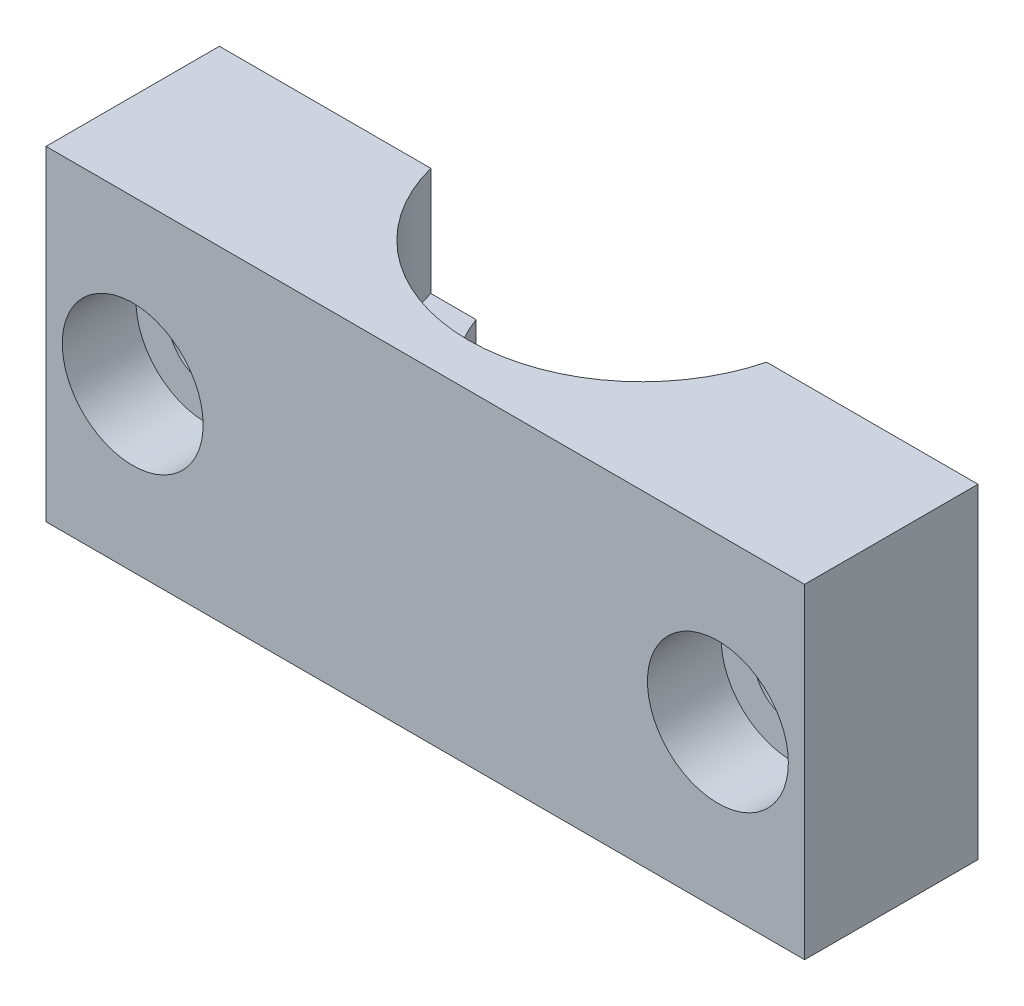
from build123d import *

# Parameters (mm, degrees)
SKETCH1_W                                           = 35
SKETCH1_H                                           = 15
BOSS_EXTRUDE1_DEPTH                                 = 10
CUT_REVOLVE1_ANGLE                                  = 180
SKETCH3_R                                           = 1.75
CUT_EXTRUDE1_DEPTH                                  = 22.505813168
CBORE_FOR_M3_HEX_SOCKET_HEAD_CAP_SCREW1_D           = 3.4
CBORE_FOR_M3_HEX_SOCKET_HEAD_CAP_SCREW1_CBORE_D     = 6.5
CBORE_FOR_M3_HEX_SOCKET_HEAD_CAP_SCREW1_CBORE_DEPTH = 3.4
SKETCH6_W                                           = 35
SKETCH6_H                                           = 4
CUT_EXTRUDE2_DEPTH                                  = 26.124689053


with BuildPart() as part:
    # Sketch1 → Boss-Extrude1 (new body)
    with BuildSketch(Plane.XY):
        Rectangle(SKETCH1_W, SKETCH1_H)
    extrude(amount=BOSS_EXTRUDE1_DEPTH)

    # Sketch2 → Cut-Revolve1 (revolve, cut)
    with BuildSketch(Plane(origin=(0, 0, 0), x_dir=(-1, 0, 0), z_dir=(0, 0, -1))):
        Polygon((0, 7.5), (8, 7.5), (8, 2.5), (6, 2.5), (6, -3.5), (8, -3.5), (8, -7.5), (0, -7.5), align=None)
    revolve(axis=Axis((0, 7.5, 0), (0, 1, 0)), revolution_arc=CUT_REVOLVE1_ANGLE, mode=Mode.SUBTRACT)

    # Sketch3 → Cut-Extrude1 (cut, through all)
    with BuildSketch(Plane.XY.offset(10)):
        with Locations((-13.5, 0)):
            Circle(SKETCH3_R)
        with Locations((13.5, 0)):
            Circle(SKETCH3_R)
    extrude(amount=-CUT_EXTRUDE1_DEPTH, mode=Mode.SUBTRACT)

    # CBORE for M3 Hex Socket Head Cap Screw1 (through all)
    with Locations(Plane.XY.offset(10)):
        with Locations((-13.5, 0), (13.5, 0)):
            CounterBoreHole(CBORE_FOR_M3_HEX_SOCKET_HEAD_CAP_SCREW1_D / 2, CBORE_FOR_M3_HEX_SOCKET_HEAD_CAP_SCREW1_CBORE_D / 2, CBORE_FOR_M3_HEX_SOCKET_HEAD_CAP_SCREW1_CBORE_DEPTH)

    # Sketch6 → Cut-Extrude2 (cut, through all)
    with BuildSketch(Plane(origin=(0, 7.5, 0), x_dir=(1, 0, 0), z_dir=(0, 1, 0))):
        Rectangle(SKETCH6_W, SKETCH6_H)
    extrude(amount=-CUT_EXTRUDE2_DEPTH, mode=Mode.SUBTRACT)


solid = part.part
